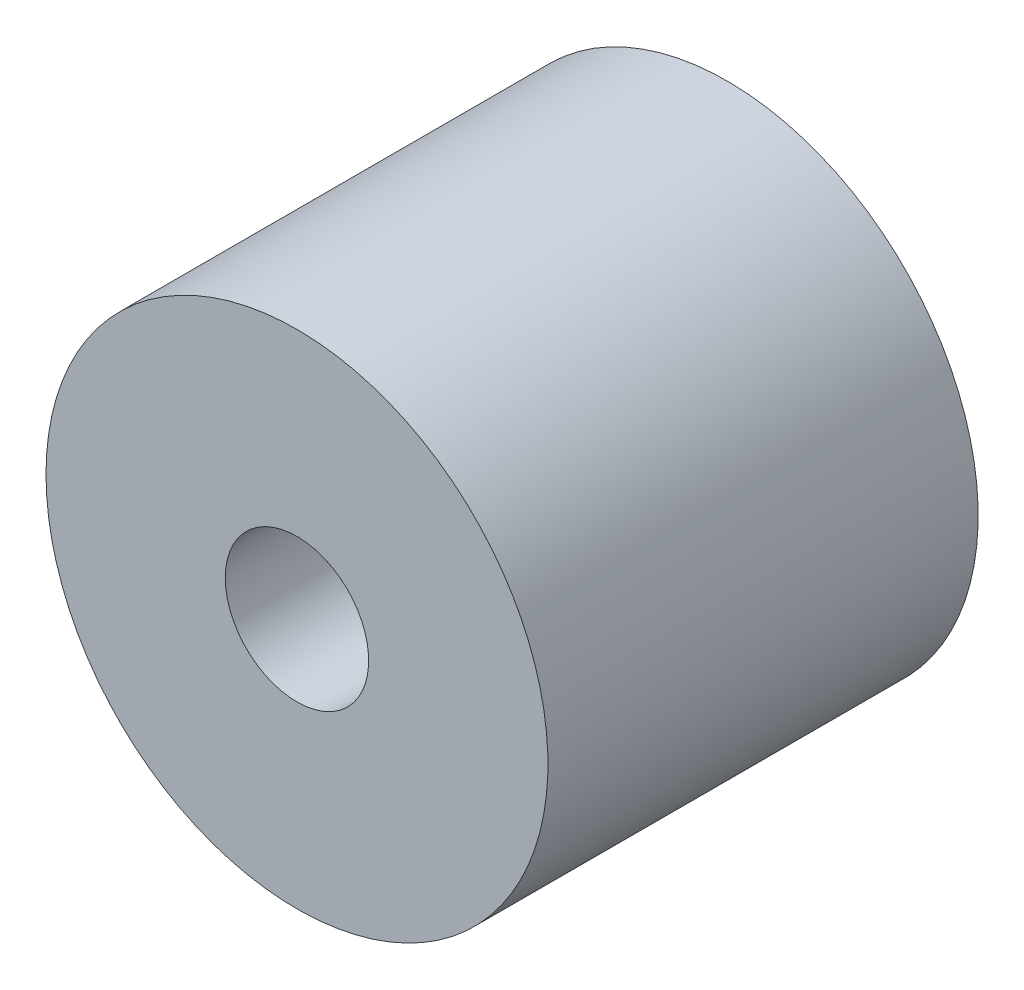
from build123d import *

# Parameters (mm, degrees)
ANNULUSPROFILE_W = 5
ANNULUSPROFILE_H = 12


with BuildPart() as part:
    # AnnulusProfile → Revolution (revolve)
    with BuildSketch(Plane(origin=(0, 0, 0), x_dir=(1, 0, 0), z_dir=(0, 1, 0)), mode=Mode.PRIVATE) as revolution_sk:
        with Locations((4.5, -6)):
            Rectangle(ANNULUSPROFILE_W, ANNULUSPROFILE_H)
    revolve(revolution_sk.sketch.rotate(Axis((0, 0, 0), (0, 0, 1)), 180), axis=Axis((0, 0, 0), (0, 0, 1)))


solid = part.part
